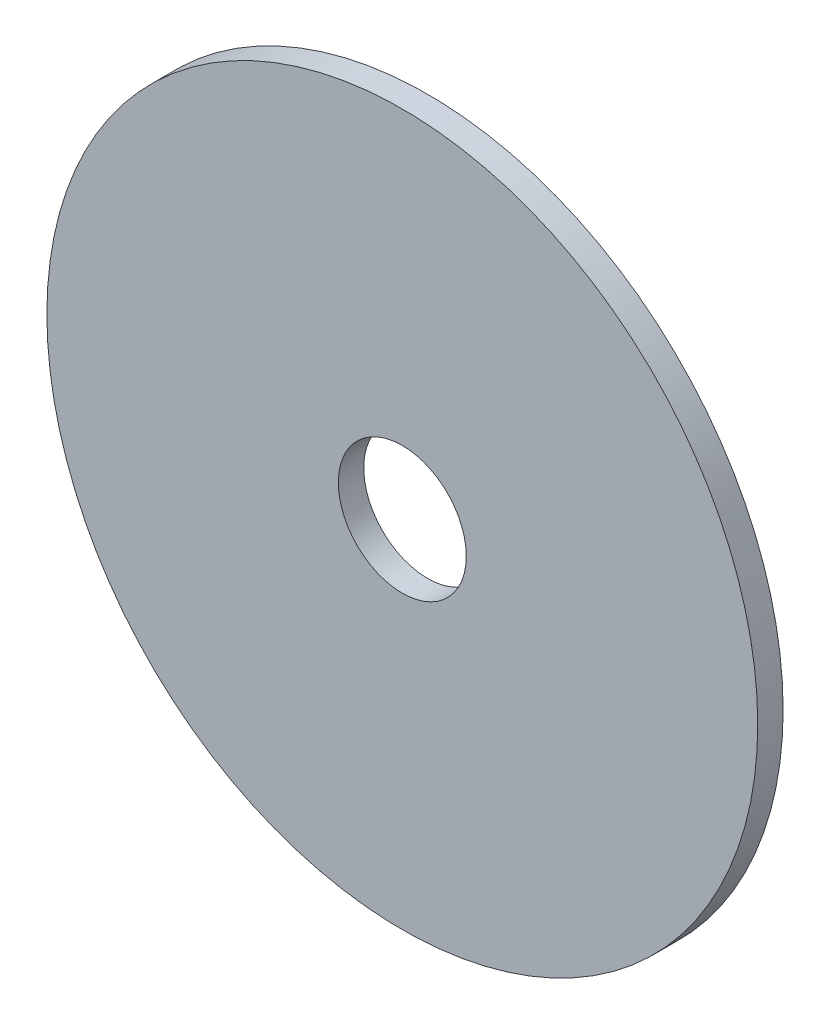
from build123d import *

# Parameters (mm, degrees)
SKETCH3_R           = 22.225
SKETCH3_R_2         = 4
BOSS_EXTRUDE1_DEPTH = 1.5875


with BuildPart() as part:
    # Sketch3 → Boss-Extrude1 (new body)
    with BuildSketch(Plane.XY):
        Circle(SKETCH3_R)
        Circle(SKETCH3_R_2, mode=Mode.SUBTRACT)
    extrude(amount=BOSS_EXTRUDE1_DEPTH)


solid = part.part
